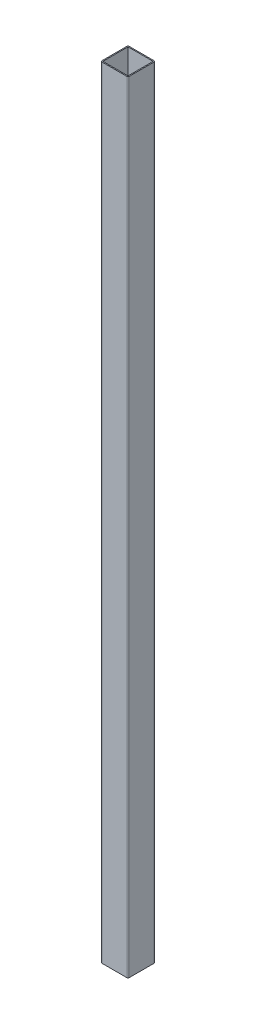
from build123d import *

# Parameters (mm, degrees)
F_8639_82_150_X_150_X_7_0_1_DEPTH = 4593


with BuildPart() as part:
    # Sketch1 → Квадратная труба гост 8639-82 150 X 150 X 7.0(1) (new body)
    with BuildSketch(Plane.XZ):
        with BuildLine():
            Line((-73.999, -80), (73.999, -80))
            ThreePointArc((73.999, -80), (78.242347794, -78.242347794), (80, -73.999))
            Line((80, -73.999), (80, 73.999))
            ThreePointArc((80, 73.999), (78.242347794, 78.242347794), (73.999, 80))
            Line((73.999, 80), (-73.999, 80))
            ThreePointArc((-73.999, 80), (-78.242347794, 78.242347794), (-80, 73.999))
            Line((-80, 73.999), (-80, -73.999))
            ThreePointArc((-80, -73.999), (-78.242347794, -78.242347794), (-73.999, -80))
        make_face()
        with BuildLine():
            Line((-73.999, -74), (73.999, -74))
            ThreePointArc((73.999, -74), (73.999707107, -73.999707107), (74, -73.999))
            Line((74, -73.999), (74, 73.999))
            ThreePointArc((74, 73.999), (73.999707107, 73.999707107), (73.999, 74))
            Line((73.999, 74), (-73.999, 74))
            ThreePointArc((-73.999, 74), (-73.999707107, 73.999707107), (-74, 73.999))
            Line((-74, 73.999), (-74, -73.999))
            ThreePointArc((-74, -73.999), (-73.999707107, -73.999707107), (-73.999, -74))
        make_face(mode=Mode.SUBTRACT)
    extrude(amount=F_8639_82_150_X_150_X_7_0_1_DEPTH)


solid = part.part
